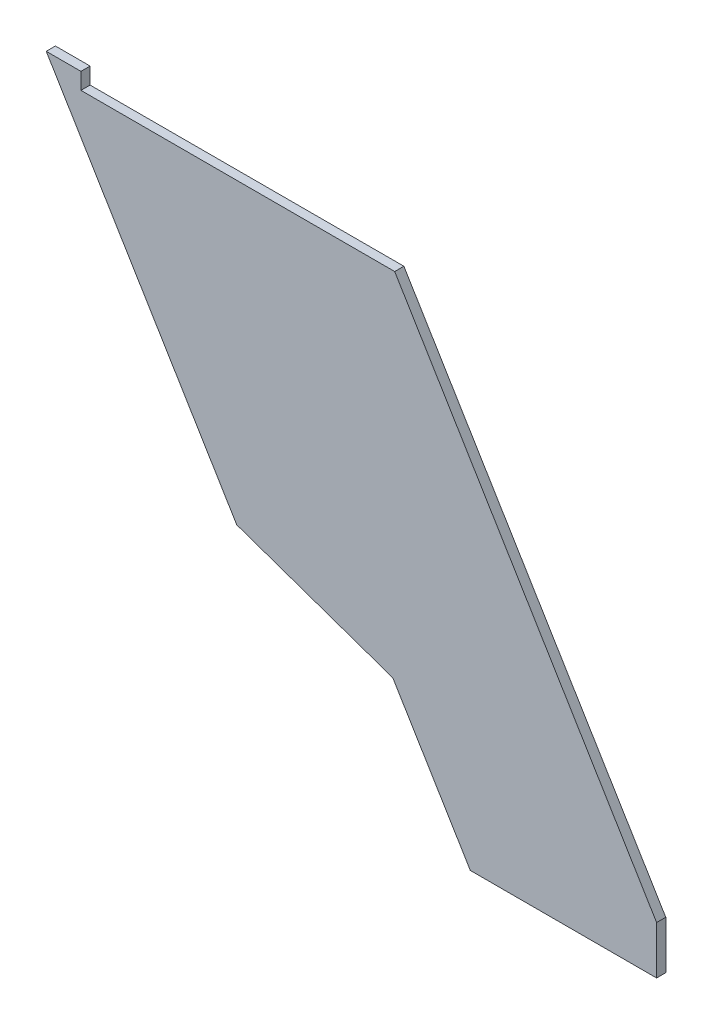
from build123d import *

# Parameters (mm, degrees)
BOSS_EXTRUDE1_DEPTH = 2.5


with BuildPart() as part:
    # Sketch1 → Boss-Extrude1 (new, symmetric)
    with BuildSketch(Plane.XY):
        Polygon((163.713404947, -144.224375), (163.713404947, -118.030625), (20.889204947, 118.030625), (-150.230595053, 118.030625), (-150.230595053, 127.022225), (-169.153595053, 127.022225), (-65.280574469, -44.660130514), (19.852041127, -74.374375), (62.113404947, -144.224375), align=None)
    extrude(amount=BOSS_EXTRUDE1_DEPTH, both=True)


solid = part.part
